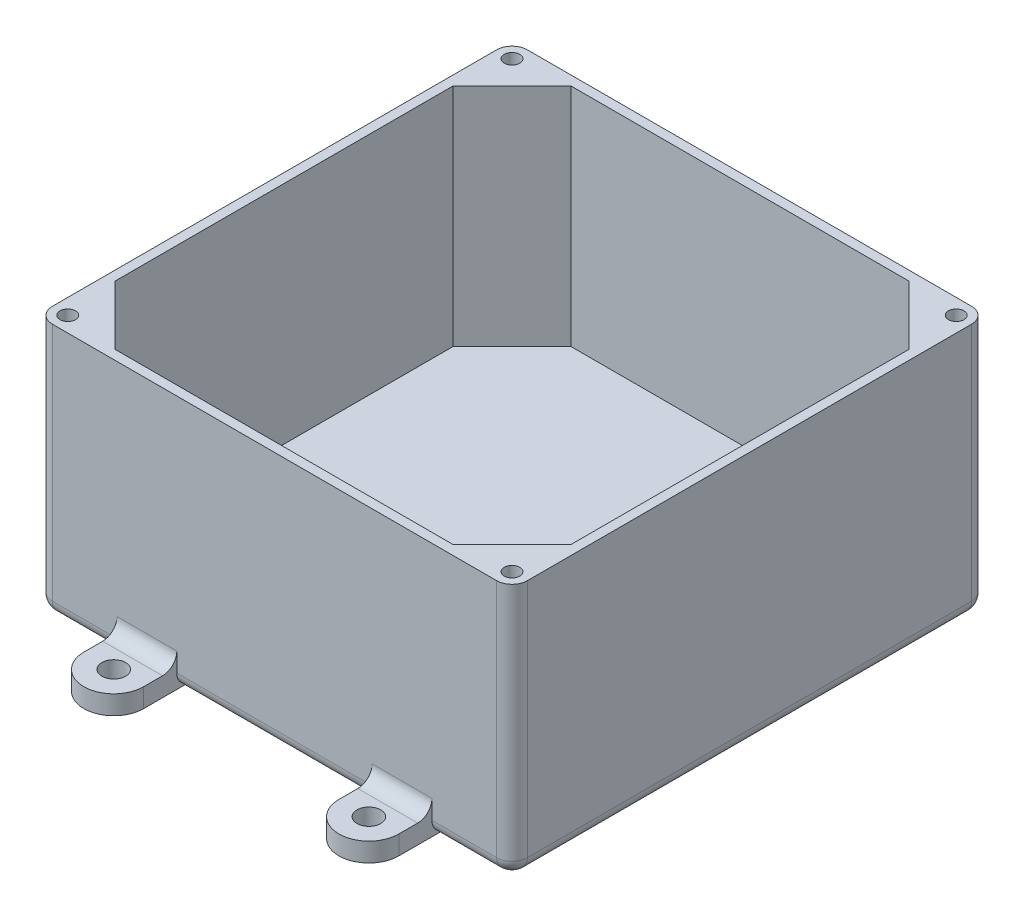
from build123d import *

# Parameters (mm, degrees)
SKETCH1_W           = 100
SKETCH1_H           = 100
BOSS_EXTRUDE1_DEPTH = 53.5
SKETCH2_R           = 2.5
SKETCH2_W           = 12.6
SKETCH2_H           = 3.072407599
BOSS_EXTRUDE2_DEPTH = 4
CUT_EXTRUDE1_DEPTH  = 47.5
FILLET1_R           = 3.25
FILLET2_R           = 3
SKETCH4_R           = 1.625
CUT_EXTRUDE2_DEPTH  = 14
FILLET3_R           = 3


with BuildPart() as part:
    # Sketch1 → Boss-Extrude1 (new body)
    with BuildSketch(Plane(origin=(0, 0, 0), x_dir=(1, 0, 0), z_dir=(0, 1, 0))):
        Rectangle(SKETCH1_W, SKETCH1_H)
    extrude(amount=BOSS_EXTRUDE1_DEPTH)

    # Sketch2 → Boss-Extrude2 (add)
    # profile 1 of 8: a face of its own
    with BuildSketch(Plane.XZ):
        with BuildLine():
            Line((33.15, -50), (20.55, -50))
            Line((20.55, -50), (20.55, -56.973787721))
            ThreePointArc((20.55, -56.973787721), (26.85, -63.273787721), (33.15, -56.973787721))
            Line((33.15, -56.973787721), (33.15, -50))
        make_face()
        with Locations(Location((26.85, -56.973787721, 0), (0, 0, 270))):
            Circle(SKETCH2_R, mode=Mode.SUBTRACT)
    # profile 2 of 8: a face of its own
    with BuildSketch(Plane.XZ):
        with BuildLine():
            Line((-20.55, -56.973787721), (-20.55, -50))
            Line((-20.55, -50), (-33.15, -50))
            Line((-33.15, -50), (-33.15, -56.973787721))
            ThreePointArc((-33.15, -56.973787721), (-26.85, -63.273787721), (-20.55, -56.973787721))
        make_face()
        with Locations(Location((-26.85, -56.973787721, 0), (0, 0, 270))):
            Circle(SKETCH2_R, mode=Mode.SUBTRACT)
    # profile 3 of 8: a face of its own
    with BuildSketch(Plane.XZ):
        with Locations((-26.85, 48.4637962)):
            Rectangle(SKETCH2_W, SKETCH2_H)
    # profile 4 of 8: a face of its own
    with BuildSketch(Plane.XZ):
        with BuildLine():
            Line((-33.15, 50), (-20.55, 50))
            Line((-20.55, 50), (-20.55, 56.973787721))
            ThreePointArc((-20.55, 56.973787721), (-26.85, 63.273787721), (-33.15, 56.973787721))
            Line((-33.15, 56.973787721), (-33.15, 50))
        make_face()
        with Locations(Location((-26.85, 56.973787721, 0), (0, 0, 270))):
            Circle(SKETCH2_R, mode=Mode.SUBTRACT)
    # profile 5 of 8: a face of its own
    with BuildSketch(Plane.XZ):
        with BuildLine():
            Line((20.55, 56.973787721), (20.55, 50))
            Line((20.55, 50), (33.15, 50))
            Line((33.15, 50), (33.15, 56.973787721))
            ThreePointArc((33.15, 56.973787721), (26.85, 63.273787721), (20.55, 56.973787721))
        make_face()
        with Locations(Location((26.85, 56.973787721, 0), (0, 0, 270))):
            Circle(SKETCH2_R, mode=Mode.SUBTRACT)
    # profile 6 of 8: a face of its own
    with BuildSketch(Plane.XZ):
        with Locations((26.85, 48.4637962)):
            Rectangle(SKETCH2_W, SKETCH2_H)
    # profile 7 of 8: a face of its own
    with BuildSketch(Plane.XZ):
        with Locations((26.85, -48.4637962)):
            Rectangle(SKETCH2_W, SKETCH2_H)
    # profile 8 of 8: a face of its own
    with BuildSketch(Plane.XZ):
        with Locations((-26.85, -48.4637962)):
            Rectangle(SKETCH2_W, SKETCH2_H)
    extrude(amount=-BOSS_EXTRUDE2_DEPTH)

    # Sketch3 → Cut-Extrude1 (cut)
    with BuildSketch(Plane(origin=(0, 53.5, 0), x_dir=(1, 0, 0), z_dir=(0, 1, 0))):
        Polygon((35.565, 48), (-35.565, 48), (-48, 35.565), (-48, -35.565), (-35.565, -48), (35.565, -48), (48, -35.565), (48, 35.565), align=None)
    extrude(amount=-CUT_EXTRUDE1_DEPTH, mode=Mode.SUBTRACT)

    # Fillet1
    fillet1_edges = [part.edges().sort_by_distance(p)[0] for p in [
        (50, 26.75, 50),
        (-50, 26.75, 50),
        (-50, 26.75, -50),
        (50, 26.75, -50),
    ]]
    fillet(fillet1_edges, radius=FILLET1_R)

    # Fillet2
    fillet2_edges = [part.edges().sort_by_distance(p)[0] for p in [
        (-26.85, 4, 50),
        (26.85, 4, 50),
        (26.85, 4, -50),
        (-26.85, 4, -50),
    ]]
    fillet(fillet2_edges, radius=FILLET2_R)

    # Sketch4 → Cut-Extrude2 (cut)
    with BuildSketch(Plane(origin=(0, 53.5, 0), x_dir=(1, 0, 0), z_dir=(0, 1, 0))):
        with Locations(Location((-46.75, 46.75, 0), (0, 0, 270))):
            Circle(SKETCH4_R)
        with Locations(Location((46.75, 46.75, 0), (0, 0, 270))):
            Circle(SKETCH4_R)
        with Locations(Location((46.75, -46.75, 0), (0, 0, 270))):
            Circle(SKETCH4_R)
        with Locations(Location((-46.75, -46.75, 0), (0, 0, 270))):
            Circle(SKETCH4_R)
    extrude(amount=-CUT_EXTRUDE2_DEPTH, mode=Mode.SUBTRACT)

    # Fillet3
    fillet3_edges = [part.edges().sort_by_distance(p)[0] for p in [
        (50, 0, 0),
        (39.95, 0, -50),
        (-39.95, 0, 50),
        (-50, 0, 0),
        (49.048097039, 0, -49.048097039),
        (-49.048097039, 0, -49.048097039),
        (-49.048097039, 0, 49.048097039),
        (49.048097039, 0, 49.048097039),
        (0, 0, 50),
        (39.95, 0, 50),
        (0, 0, -50),
        (-39.95, 0, -50),
    ]]
    fillet(fillet3_edges, radius=FILLET3_R)


solid = part.part
